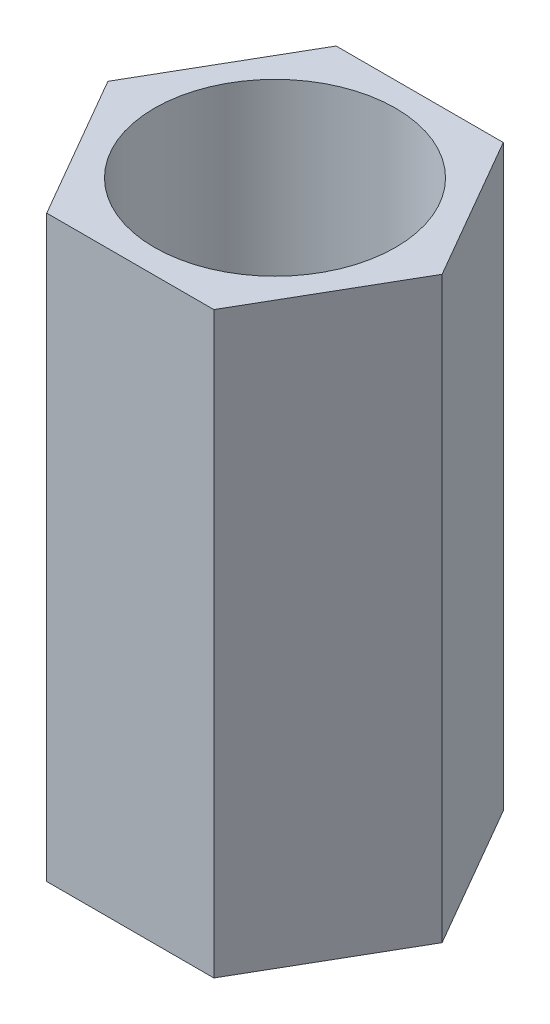
from build123d import *

# Parameters (mm, degrees)
SKETCH1_R           = 1.25
BOSS_EXTRUDE1_DEPTH = 6


with BuildPart() as part:
    # Sketch1 → Boss-Extrude1 (new body)
    with BuildSketch(Plane(origin=(0, 0, 0), x_dir=(1, 0, 0), z_dir=(0, 1, 0))):
        Polygon((0.866025404, -1.5), (1.732050808, 0), (0.866025404, 1.5), (-0.866025404, 1.5), (-1.732050808, 0), (-0.866025404, -1.5), align=None)
        with Locations(Location((0, 0, 0), (0, 0, 270))):
            Circle(SKETCH1_R, mode=Mode.SUBTRACT)
    extrude(amount=BOSS_EXTRUDE1_DEPTH)


solid = part.part
